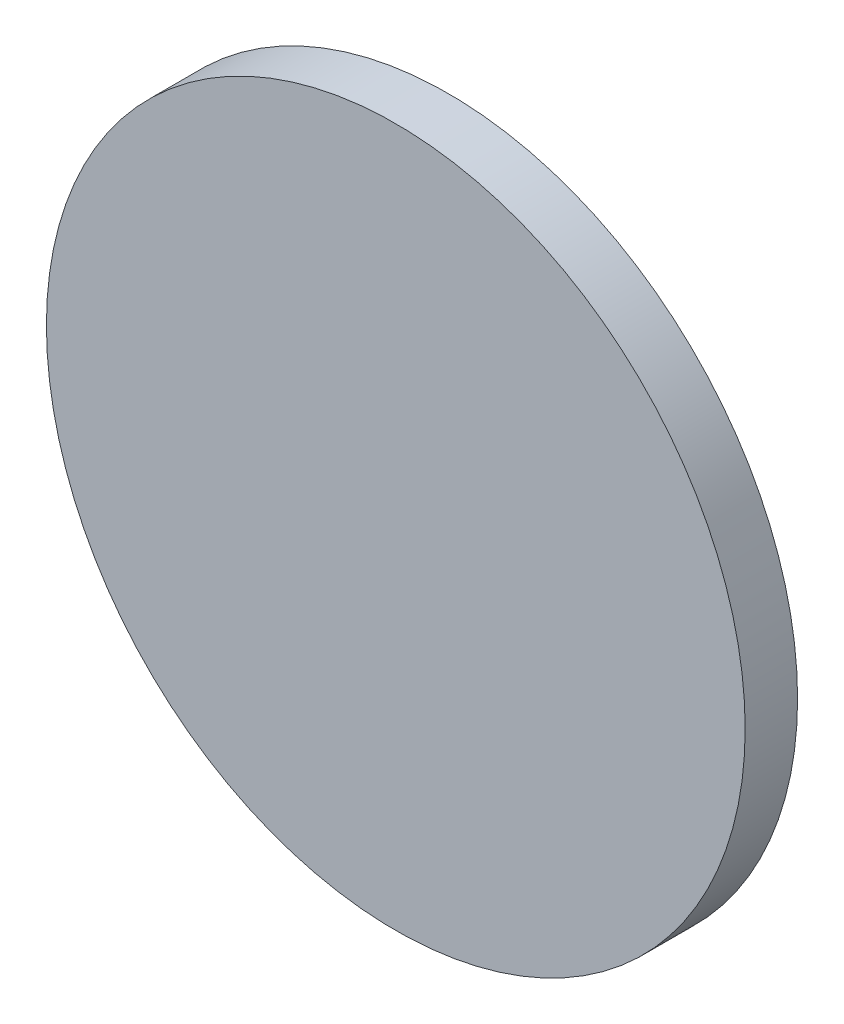
from build123d import *

# Parameters (mm, degrees)
SKETCH1_R           = 100
BOSS_EXTRUDE1_DEPTH = 15


with BuildPart() as part:
    # Sketch1 → Boss-Extrude1 (new body)
    with BuildSketch(Plane.XY):
        Circle(SKETCH1_R)
    extrude(amount=BOSS_EXTRUDE1_DEPTH)


solid = part.part
